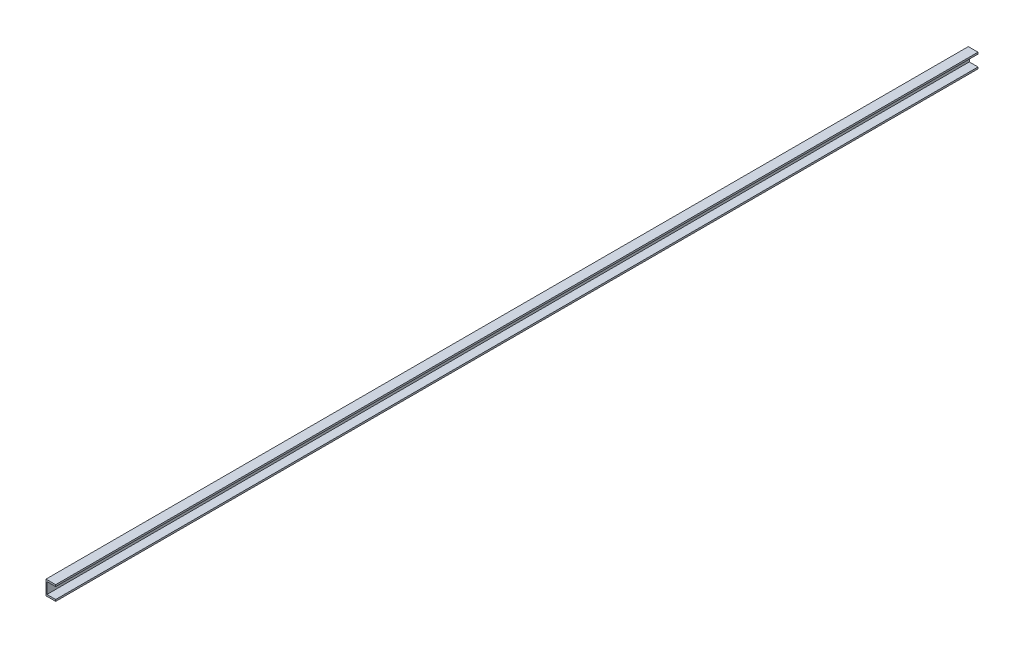
from build123d import *

# Parameters (mm, degrees)
BOSS_EXTRUDE1_DEPTH = 5062


with BuildPart() as part:
    # Sketch1 → Boss-Extrude1 (new body)
    with BuildSketch(Plane.XY):
        Polygon((0, 0), (0, 41.157769231), (53.086, 41.157769231), (53.086, 31.861369231), (5.334, 31.861369231), (5.334, -29.282292308), (53.086, -29.282292308), (53.086, -38.578692308), (0, -38.578692308), align=None)
    extrude(amount=BOSS_EXTRUDE1_DEPTH)


solid = part.part
